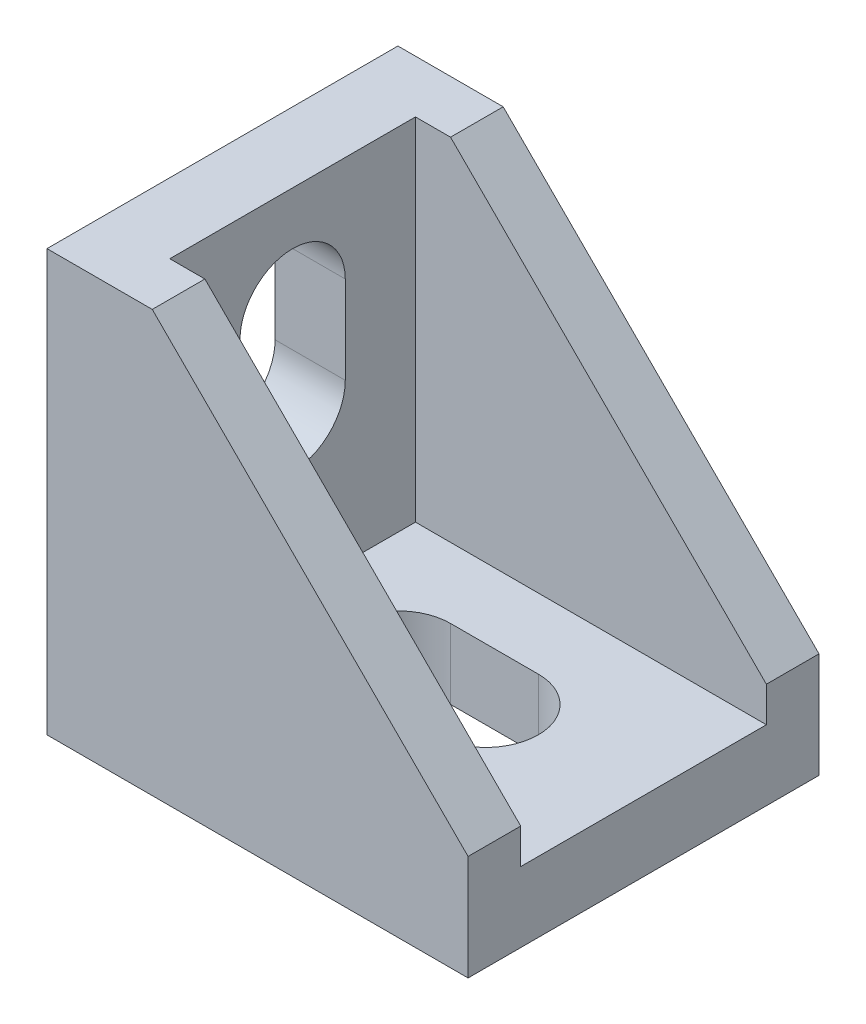
from build123d import *

# Parameters (mm, degrees)
EXTRUDE_1_DEPTH     = 20
CUT_EXTRUDE_START   = -3
SKETCH_2_W          = 24
SKETCH_2_H          = 24
CUT_EXTRUDE_1_DEPTH = 14
CUT_EXTRUDE_2_DEPTH = 12
CUT_EXTRUDE_3_DEPTH = 12
SKETCH_5_W          = 6
SKETCH_5_H          = 4
SKETCH_5_W_2        = 4
SKETCH_5_H_2        = 6
CUT_EXTRUDE_4_DEPTH = 30


with BuildPart() as part:
    # 草图1 → 凸台-拉伸1 (new body)
    with BuildSketch(Plane.XY):
        Polygon((0, 28), (0, 0), (28, 0), (28, 6), (24, 6), (6, 24), (6, 28), align=None)
    extrude(amount=EXTRUDE_1_DEPTH)

    # 草图2 → 切除-拉伸1 (cut)
    with BuildSketch(Plane.XY.offset(20).offset(CUT_EXTRUDE_START)):
        with Locations((16, 16)):
            Rectangle(SKETCH_2_W, SKETCH_2_H)
    extrude(amount=-CUT_EXTRUDE_1_DEPTH, mode=Mode.SUBTRACT)

    # 草图3 → 切除-拉伸2 (cut)
    with BuildSketch(Plane(origin=(0, 4, 0), x_dir=(1, 0, 0), z_dir=(0, 1, 0))):
        with BuildLine():
            Line((10, -13), (15, -13))
            ThreePointArc((15, -13), (18, -10), (15, -7))
            Line((15, -7), (10, -7))
            ThreePointArc((10, -7), (7, -10), (10, -13))
        make_face()
    extrude(amount=-CUT_EXTRUDE_2_DEPTH, mode=Mode.SUBTRACT)

    # 草图4 → 切除-拉伸3 (cut)
    with BuildSketch(Plane(origin=(4, 0, 0), x_dir=(0, 0, -1), z_dir=(1, 0, 0))):
        with BuildLine():
            Line((-13, 18), (-13, 13))
            ThreePointArc((-13, 13), (-10, 10), (-7, 13))
            Line((-7, 13), (-7, 18))
            ThreePointArc((-7, 18), (-10, 21), (-13, 18))
        make_face()
    extrude(amount=-CUT_EXTRUDE_3_DEPTH, mode=Mode.SUBTRACT)

    # 草图5 → 切除-拉伸4 (cut)
    with BuildSketch(Plane(origin=(0, 0, 0), x_dir=(-1, 0, 0), z_dir=(0, 0, -1))):
        with Locations((-3, 26)):
            Rectangle(SKETCH_5_W, SKETCH_5_H)
        with Locations((-26, 3)):
            Rectangle(SKETCH_5_W_2, SKETCH_5_H_2)
    extrude(amount=-CUT_EXTRUDE_4_DEPTH, mode=Mode.SUBTRACT)


solid = part.part
